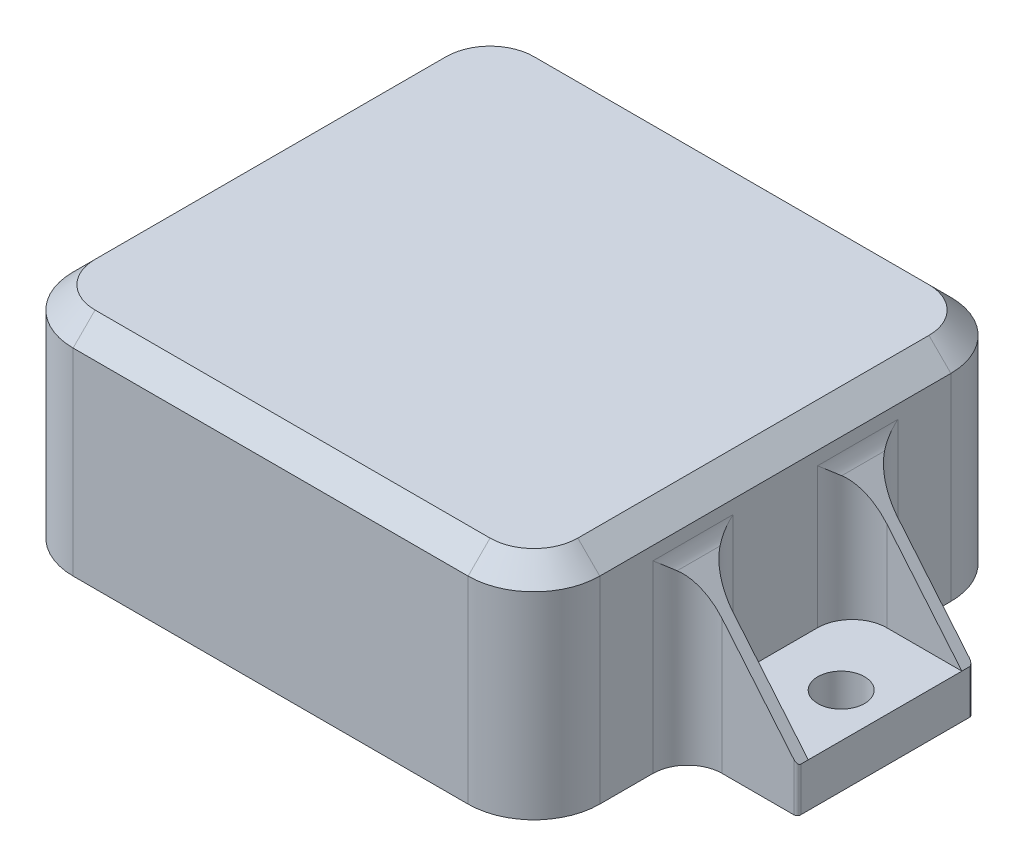
from build123d import *

# Parameters (mm, degrees)
SKETCH1_W                      = 76.2
SKETCH1_H                      = 69.85
BOSS_EXTRUDE1_DEPTH            = 31.75
FILLET1_R                      = 9.525
CUT_EXTRUDE1_DEPTH             = 28.575
CUT_EXTRUDE3_DEPTH             = 4.7625
BOSS_EXTRUDE3_DEPTH            = 12.7
F_1_4_CLEARANCE_HOLE2_D        = 6.7564
SKETCH15_W                     = 22.225
SKETCH15_H                     = 19.05
CUT_EXTRUDE5_DEPTH             = 90.634023256
FILLET2_R                      = 5.0165
FILLET3_R                      = 3.429
FILLET4_R                      = 0.508
CHAMFER1_SIZE                  = 3.175
F_2_56_TAPPED_HOLE1_AT_2_COUNT = 2
F_2_56_TAPPED_HOLE1_AT_2_PITCH = 23.188196847
CUT_EXTRUDE4_REACH             = 95.81
SKETCH14_R                     = 6.35
F_4_40_TAPPED_HOLE1_REACH      = 129.201
F_4_40_TAPPED_HOLE1_BORE_R     = 1.1303


with BuildPart() as part:
    # Sketch1 → Boss-Extrude1 (new body)
    with BuildSketch(Plane(origin=(0, 0, 0), x_dir=(1, 0, 0), z_dir=(0, 1, 0))):
        Rectangle(SKETCH1_W, SKETCH1_H)
    extrude(amount=BOSS_EXTRUDE1_DEPTH)

    # Fillet1
    fillet1_edges = [part.edges().sort_by_distance(p)[0] for p in [
        (38.1, 15.875, 34.925),
        (-38.1, 15.875, 34.925),
        (-38.1, 15.875, -34.925),
        (38.1, 15.875, -34.925),
    ]]
    fillet(fillet1_edges, radius=FILLET1_R)

    # Sketch2 → Cut-Extrude1 (cut)
    with BuildSketch(Plane.XZ):
        with BuildLine():
            Line((31.75, -25.4), (31.75, 25.4))
            ThreePointArc((31.75, 25.4), (30.82006403, 27.64506403), (28.575, 28.575))
            Line((28.575, 28.575), (-28.575, 28.575))
            ThreePointArc((-28.575, 28.575), (-30.82006403, 27.64506403), (-31.75, 25.4))
            Line((-31.75, 25.4), (-31.75, -25.4))
            ThreePointArc((-31.75, -25.4), (-30.82006403, -27.64506403), (-28.575, -28.575))
            Line((-28.575, -28.575), (28.575, -28.575))
            ThreePointArc((28.575, -28.575), (30.82006403, -27.64506403), (31.75, -25.4))
        make_face()
    extrude(amount=-CUT_EXTRUDE1_DEPTH, mode=Mode.SUBTRACT)

    # Sketch11 → Cut-Extrude3 (cut)
    with BuildSketch(Plane.XZ):
        with BuildLine():
            Line((36.5125, -25.4), (36.5125, 25.4))
            ThreePointArc((36.5125, 25.4), (34.187660076, 31.012660076), (28.575, 33.3375))
            Line((28.575, 33.3375), (-28.575, 33.3375))
            ThreePointArc((-28.575, 33.3375), (-34.187660076, 31.012660076), (-36.5125, 25.4))
            Line((-36.5125, 25.4), (-36.5125, -25.4))
            ThreePointArc((-36.5125, -25.4), (-34.187660076, -31.012660076), (-28.575, -33.3375))
            Line((-28.575, -33.3375), (28.575, -33.3375))
            ThreePointArc((28.575, -33.3375), (34.187660076, -31.012660076), (36.5125, -25.4))
        make_face()
    extrude(amount=-CUT_EXTRUDE3_DEPTH, mode=Mode.SUBTRACT)

    # Sketch4 → Boss-Extrude3 (add, symmetric)
    with BuildSketch(Plane.XY):
        Polygon((-38.1, 0), (-53.975, 0), (-53.975, 6.35), (-38.1, 25.4), align=None)
    boss_extrude3 = extrude(amount=BOSS_EXTRUDE3_DEPTH, both=True)

    # 1/4 Clearance Hole2 (through all)
    with Locations(Plane(origin=(-13.566959835, 0, 0), x_dir=(1, 0, 0), z_dir=(0, -1, 0))):
        with Locations((-34.058040165, 0)):
            f_1_4_clearance_hole2 = Hole(F_1_4_CLEARANCE_HOLE2_D / 2)

    # Sketch15 → Cut-Extrude5 (cut, through all)
    with BuildSketch(Plane.ZY.offset(38.1)):
        with Locations((0, 15.875)):
            Rectangle(SKETCH15_W, SKETCH15_H)
    cut_extrude5 = extrude(amount=CUT_EXTRUDE5_DEPTH, mode=Mode.SUBTRACT)

    # Mirror4: Boss-Extrude3, 1/4 Clearance Hole2, Cut-Extrude5 across plane
    add(boss_extrude3.mirror(Plane(origin=(0, 0, 0), x_dir=(0, 0, 1), z_dir=(1, 0, 0))))
    add(f_1_4_clearance_hole2.mirror(Plane(origin=(0, 0, 0), x_dir=(0, 0, 1), z_dir=(1, 0, 0))), mode=Mode.SUBTRACT)
    add(cut_extrude5.mirror(Plane(origin=(0, 0, 0), x_dir=(0, 0, 1), z_dir=(1, 0, 0))), mode=Mode.SUBTRACT)

    # Fillet2
    fillet2_edges = [part.edges().sort_by_distance(p)[0] for p in [
        (-38.1, 12.7, -12.7),
        (-38.1, 12.7, 12.7),
        (-38.1, 15.875, 11.1125),
        (-38.1, 15.875, -11.1125),
        (38.1, 12.7, 12.7),
        (38.1, 12.7, -12.7),
        (38.1, 15.875, 11.1125),
        (38.1, 15.875, -11.1125),
    ]]
    fillet(fillet2_edges, radius=FILLET2_R)

    # Fillet3
    fillet3_edges = [part.edges().sort_by_distance(p)[0] for p in [
        (-38.1, 25.4, 11.90625),
        (-38.1, 25.4, -11.90625),
        (38.1, 25.4, -11.90625),
        (38.1, 25.4, 11.90625),
    ]]
    fillet(fillet3_edges, radius=FILLET3_R)

    # Fillet4
    fillet4_edges = [part.edges().sort_by_distance(p)[0] for p in [
        (-53.975, 3.175, -12.7),
        (-53.975, 3.175, 12.7),
        (53.975, 3.175, 12.7),
        (53.975, 3.175, -12.7),
    ]]
    fillet(fillet4_edges, radius=FILLET4_R)

    # Chamfer1
    chamfer1_edges = [part.edges().sort_by_distance(p)[0] for p in [
        (-38.1, 31.75, 0),
        (0, 31.75, -34.925),
        (38.1, 31.75, 0),
        (0, 31.75, 34.925),
        (-35.310192091, 31.75, 32.135192091),
        (35.310192091, 31.75, 32.135192091),
        (35.310192091, 31.75, -32.135192091),
        (-35.310192091, 31.75, -32.135192091),
    ]]
    chamfer(chamfer1_edges, length=CHAMFER1_SIZE)

    # Sketch13 → #2-56 Tapped Hole1 (revolve, cut)
    with BuildSketch(Plane(origin=(-15.875, 4.7625, 30.607), x_dir=(0, 0, -1), z_dir=(1, 0, 0))):
        Polygon((0, 0), (0, 6.12216509), (0.889, 5.588), (0.889, 0), align=None)
    f_2_56_tapped_hole1 = revolve(axis=Axis((-15.875, -1.5875, 30.607), (0, 1, 0)), mode=Mode.SUBTRACT)

    # #2-56 Tapped Hole1 at 2: #2-56 Tapped Hole1 ×2
    with Locations(*[Vector(-0.7722463337018893, 0, -0.6353232248894969) * (i * F_2_56_TAPPED_HOLE1_AT_2_PITCH) for i in range(1, F_2_56_TAPPED_HOLE1_AT_2_COUNT)]):
        add(f_2_56_tapped_hole1, mode=Mode.SUBTRACT)

    # Mirror2: #2-56 Tapped Hole1 across plane
    add(f_2_56_tapped_hole1.mirror(Plane.XY), mode=Mode.SUBTRACT)

    # Mirror2 copy 1 sketch → Mirror2 copy 1 (revolve, cut)
    with BuildSketch(Plane(origin=(-33.782, 4.7625, -15.875), x_dir=(0, 0, 1), z_dir=(1, 0, 0))):
        Polygon((0, 0), (0, -6.12216509), (0.889, -5.588), (0.889, 0), align=None)
    revolve(axis=Axis((-33.782, -1.5875, -15.875), (0, -1, 0)), mode=Mode.SUBTRACT)

    # Mirror3: #2-56 Tapped Hole1 across plane
    add(f_2_56_tapped_hole1.mirror(Plane(origin=(0, 0, 0), x_dir=(0, 0, 1), z_dir=(1, 0, 0))), mode=Mode.SUBTRACT)

    # Mirror3 copy 1 sketch → Mirror3 copy 1 (revolve, cut)
    with BuildSketch(Plane(origin=(33.782, 4.7625, 15.875), x_dir=(0, 0, -1), z_dir=(-1, 0, 0))):
        Polygon((0, 0), (0, -6.12216509), (0.889, -5.588), (0.889, 0), align=None)
    revolve(axis=Axis((33.782, -1.5875, 15.875), (0, -1, 0)), mode=Mode.SUBTRACT)

    # Mirror3 copy 2 sketch → Mirror3 copy 2 (revolve, cut)
    with BuildSketch(Plane(origin=(15.875, 4.7625, -30.607), x_dir=(0, 0, 1), z_dir=(-1, 0, 0))):
        Polygon((0, 0), (0, 6.12216509), (0.889, 5.588), (0.889, 0), align=None)
    revolve(axis=Axis((15.875, -1.5875, -30.607), (0, 1, 0)), mode=Mode.SUBTRACT)

    # Mirror3 copy 3 sketch → Mirror3 copy 3 (revolve, cut)
    with BuildSketch(Plane(origin=(33.782, 4.7625, -15.875), x_dir=(0, 0, 1), z_dir=(-1, 0, 0))):
        Polygon((0, 0), (0, 6.12216509), (0.889, 5.588), (0.889, 0), align=None)
    revolve(axis=Axis((33.782, -1.5875, -15.875), (0, 1, 0)), mode=Mode.SUBTRACT)

    # Sketch14 → Cut-Extrude4 (cut, up to next)
    with BuildSketch(Plane(origin=(0, 0, -34.925), x_dir=(-1, 0, 0), z_dir=(0, 0, -1)), mode=Mode.PRIVATE) as cut_extrude4_sk1:
        with Locations((-15.875, 15.875)):
            Circle(SKETCH14_R)
    cut_extrude4_tool1 = extrude(cut_extrude4_sk1.sketch, amount=-CUT_EXTRUDE4_REACH, mode=Mode.PRIVATE) & part.part
    # Sketch14 → Cut-Extrude4 (cut, up to next)
    with BuildSketch(Plane(origin=(0, 0, -34.925), x_dir=(-1, 0, 0), z_dir=(0, 0, -1)), mode=Mode.PRIVATE) as cut_extrude4_sk2:
        with Locations((15.875, 15.875)):
            Circle(SKETCH14_R)
    cut_extrude4_tool2 = extrude(cut_extrude4_sk2.sketch, amount=-CUT_EXTRUDE4_REACH, mode=Mode.PRIVATE) & part.part
    add(cut_extrude4_tool1.solids().sort_by_distance((15.875, 15.875, -34.925))[0], mode=Mode.SUBTRACT)
    add(cut_extrude4_tool2.solids().sort_by_distance((-15.875, 15.875, -34.925))[0], mode=Mode.SUBTRACT)

    # #4-40 Tapped Hole1 bore → #4-40 Tapped Hole1 (cut, up to next)
    with BuildSketch(Plane(origin=(-13.435602358, -50.449576404, -34.925), x_dir=(-1, 0, 0), z_dir=(0, 0, -1)), mode=Mode.PRIVATE) as f_4_40_tapped_hole1_sk1:
        with Locations((-5.104402358, 73.868376404)):
            Circle(F_4_40_TAPPED_HOLE1_BORE_R)
    f_4_40_tapped_hole1_tool1 = extrude(f_4_40_tapped_hole1_sk1.sketch, amount=-F_4_40_TAPPED_HOLE1_REACH, mode=Mode.PRIVATE) & part.part
    # #4-40 Tapped Hole1 bore → #4-40 Tapped Hole1 (cut, up to next)
    with BuildSketch(Plane(origin=(-13.435602358, -50.449576404, -34.925), x_dir=(-1, 0, 0), z_dir=(0, 0, -1)), mode=Mode.PRIVATE) as f_4_40_tapped_hole1_sk2:
        with Locations((9.983197642, 73.868376404)):
            Circle(F_4_40_TAPPED_HOLE1_BORE_R)
    f_4_40_tapped_hole1_tool2 = extrude(f_4_40_tapped_hole1_sk2.sketch, amount=-F_4_40_TAPPED_HOLE1_REACH, mode=Mode.PRIVATE) & part.part
    # #4-40 Tapped Hole1 bore → #4-40 Tapped Hole1 (cut, up to next)
    with BuildSketch(Plane(origin=(-13.435602358, -50.449576404, -34.925), x_dir=(-1, 0, 0), z_dir=(0, 0, -1)), mode=Mode.PRIVATE) as f_4_40_tapped_hole1_sk3:
        with Locations((9.983197642, 58.780776404)):
            Circle(F_4_40_TAPPED_HOLE1_BORE_R)
    f_4_40_tapped_hole1_tool3 = extrude(f_4_40_tapped_hole1_sk3.sketch, amount=-F_4_40_TAPPED_HOLE1_REACH, mode=Mode.PRIVATE) & part.part
    # #4-40 Tapped Hole1 bore → #4-40 Tapped Hole1 (cut, up to next)
    with BuildSketch(Plane(origin=(-13.435602358, -50.449576404, -34.925), x_dir=(-1, 0, 0), z_dir=(0, 0, -1)), mode=Mode.PRIVATE) as f_4_40_tapped_hole1_sk4:
        with Locations((-5.104402358, 58.780776404)):
            Circle(F_4_40_TAPPED_HOLE1_BORE_R)
    f_4_40_tapped_hole1_tool4 = extrude(f_4_40_tapped_hole1_sk4.sketch, amount=-F_4_40_TAPPED_HOLE1_REACH, mode=Mode.PRIVATE) & part.part
    # #4-40 Tapped Hole1 bore → #4-40 Tapped Hole1 (cut, up to next)
    with BuildSketch(Plane(origin=(-13.435602358, -50.449576404, -34.925), x_dir=(-1, 0, 0), z_dir=(0, 0, -1)), mode=Mode.PRIVATE) as f_4_40_tapped_hole1_sk5:
        with Locations((-21.766802358, 58.780776404)):
            Circle(F_4_40_TAPPED_HOLE1_BORE_R)
    f_4_40_tapped_hole1_tool5 = extrude(f_4_40_tapped_hole1_sk5.sketch, amount=-F_4_40_TAPPED_HOLE1_REACH, mode=Mode.PRIVATE) & part.part
    # #4-40 Tapped Hole1 bore → #4-40 Tapped Hole1 (cut, up to next)
    with BuildSketch(Plane(origin=(-13.435602358, -50.449576404, -34.925), x_dir=(-1, 0, 0), z_dir=(0, 0, -1)), mode=Mode.PRIVATE) as f_4_40_tapped_hole1_sk6:
        with Locations((-21.766802358, 73.868376404)):
            Circle(F_4_40_TAPPED_HOLE1_BORE_R)
    f_4_40_tapped_hole1_tool6 = extrude(f_4_40_tapped_hole1_sk6.sketch, amount=-F_4_40_TAPPED_HOLE1_REACH, mode=Mode.PRIVATE) & part.part
    # #4-40 Tapped Hole1 bore → #4-40 Tapped Hole1 (cut, up to next)
    with BuildSketch(Plane(origin=(-13.435602358, -50.449576404, -34.925), x_dir=(-1, 0, 0), z_dir=(0, 0, -1)), mode=Mode.PRIVATE) as f_4_40_tapped_hole1_sk7:
        with Locations((-36.854402358, 73.868376404)):
            Circle(F_4_40_TAPPED_HOLE1_BORE_R)
    f_4_40_tapped_hole1_tool7 = extrude(f_4_40_tapped_hole1_sk7.sketch, amount=-F_4_40_TAPPED_HOLE1_REACH, mode=Mode.PRIVATE) & part.part
    # #4-40 Tapped Hole1 bore → #4-40 Tapped Hole1 (cut, up to next)
    with BuildSketch(Plane(origin=(-13.435602358, -50.449576404, -34.925), x_dir=(-1, 0, 0), z_dir=(0, 0, -1)), mode=Mode.PRIVATE) as f_4_40_tapped_hole1_sk8:
        with Locations((-36.854402358, 58.780776404)):
            Circle(F_4_40_TAPPED_HOLE1_BORE_R)
    f_4_40_tapped_hole1_tool8 = extrude(f_4_40_tapped_hole1_sk8.sketch, amount=-F_4_40_TAPPED_HOLE1_REACH, mode=Mode.PRIVATE) & part.part
    add(f_4_40_tapped_hole1_tool1.solids().sort_by_distance((-8.3312, 23.4188, -34.925))[0], mode=Mode.SUBTRACT)
    add(f_4_40_tapped_hole1_tool2.solids().sort_by_distance((-23.4188, 23.4188, -34.925))[0], mode=Mode.SUBTRACT)
    add(f_4_40_tapped_hole1_tool3.solids().sort_by_distance((-23.4188, 8.3312, -34.925))[0], mode=Mode.SUBTRACT)
    add(f_4_40_tapped_hole1_tool4.solids().sort_by_distance((-8.3312, 8.3312, -34.925))[0], mode=Mode.SUBTRACT)
    add(f_4_40_tapped_hole1_tool5.solids().sort_by_distance((8.3312, 8.3312, -34.925))[0], mode=Mode.SUBTRACT)
    add(f_4_40_tapped_hole1_tool6.solids().sort_by_distance((8.3312, 23.4188, -34.925))[0], mode=Mode.SUBTRACT)
    add(f_4_40_tapped_hole1_tool7.solids().sort_by_distance((23.4188, 23.4188, -34.925))[0], mode=Mode.SUBTRACT)
    add(f_4_40_tapped_hole1_tool8.solids().sort_by_distance((23.4188, 8.3312, -34.925))[0], mode=Mode.SUBTRACT)


solid = part.part
